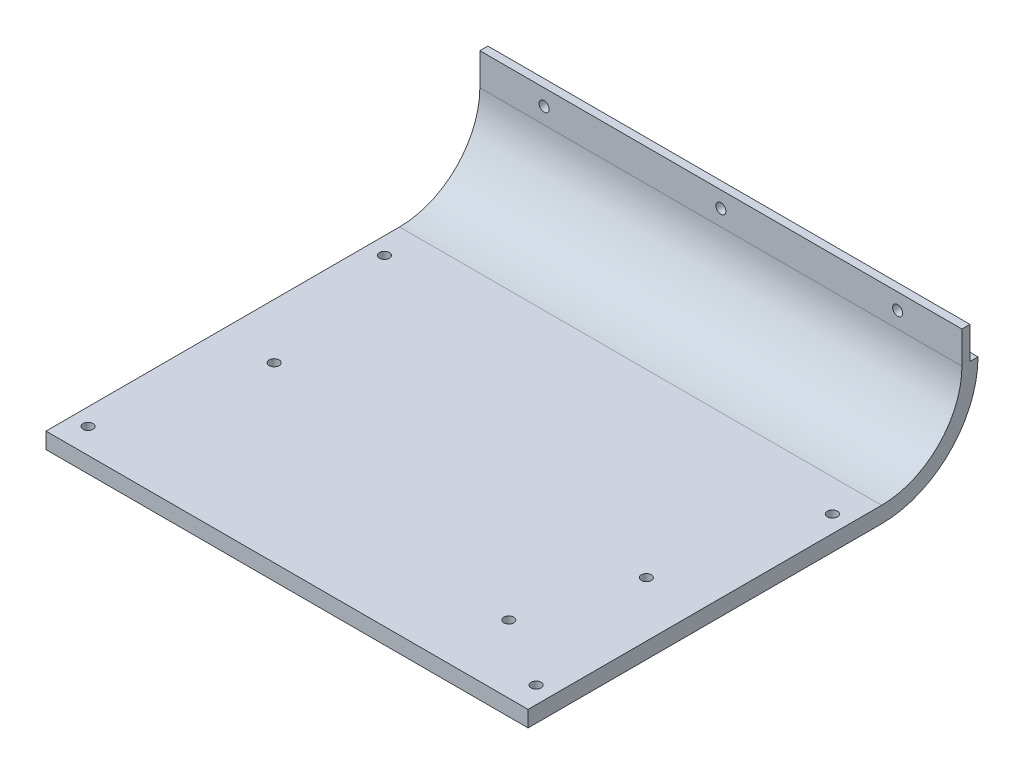
from build123d import *

# Parameters (mm, degrees)
BOSS_EXTRUDE1_DEPTH      = 190.5
BOSS_EXTRUDE1_DEPTH_BACK = 190.5
SKETCH2_W                = 381
SKETCH2_H                = 6.35
BOSS_EXTRUDE2_DEPTH      = 25.4
SKETCH3_R                = 3.96875
CUT_EXTRUDE1_DEPTH       = 25.4
SKETCH4_R                = 3.937
CUT_EXTRUDE2_DEPTH       = 302.34078715


with BuildPart() as part:
    # Sketch1 → Boss-Extrude1 (new, two sides: drawn at the far end of the back side and taken through both)
    with BuildSketch(Plane(origin=(0, 0, 0), x_dir=(0, 0, -1), z_dir=(1, 0, 0)).offset(-BOSS_EXTRUDE1_DEPTH_BACK)):
        with BuildLine():
            Line((-139.7, 0), (139.7, 0))
            ThreePointArc((139.7, 0), (193.581536726, 22.318463274), (215.9, 76.2))
            Line((215.9, 76.2), (203.2, 76.2))
            ThreePointArc((203.2, 76.2), (184.601280605, 31.298719395), (139.7, 12.7))
            Line((139.7, 12.7), (-139.7, 12.7))
            Line((-139.7, 12.7), (-139.7, 0))
        make_face()
    extrude(amount=BOSS_EXTRUDE1_DEPTH + BOSS_EXTRUDE1_DEPTH_BACK)

    # Sketch2 → Boss-Extrude2 (add)
    with BuildSketch(Plane(origin=(0, 76.2, 0), x_dir=(1, 0, 0), z_dir=(0, 1, 0))):
        with Locations((0, 206.375)):
            Rectangle(SKETCH2_W, SKETCH2_H)
    extrude(amount=BOSS_EXTRUDE2_DEPTH)

    # Sketch3 → Cut-Extrude1 (cut)
    with BuildSketch(Plane(origin=(0, 0, -209.55), x_dir=(-1, 0, 0), z_dir=(0, 0, -1))):
        with Locations((-139.7, 88.9)):
            Circle(SKETCH3_R)
        with Locations((139.7, 88.9)):
            Circle(SKETCH3_R)
        with Locations((0, 88.9)):
            Circle(SKETCH3_R)
    extrude(amount=-CUT_EXTRUDE1_DEPTH, mode=Mode.SUBTRACT)

    # Sketch4 → Cut-Extrude2 (cut, through all)
    with BuildSketch(Plane(origin=(0, 12.7, 0), x_dir=(1, 0, 0), z_dir=(0, 1, 0))):
        with Locations((177.038, -119.888)):
            Circle(SKETCH4_R)
        with Locations((177.038, 114.3)):
            Circle(SKETCH4_R)
        with Locations((-177.038, -119.888)):
            Circle(SKETCH4_R)
        with Locations((-177.038, 114.3)):
            Circle(SKETCH4_R)
        with Locations((147.066, -2.794)):
            Circle(SKETCH4_R)
        with Locations((-147.066, -2.794)):
            Circle(SKETCH4_R)
        with Locations((121.666, -86.106)):
            Circle(SKETCH4_R)
    extrude(amount=-CUT_EXTRUDE2_DEPTH, mode=Mode.SUBTRACT)


solid = part.part
